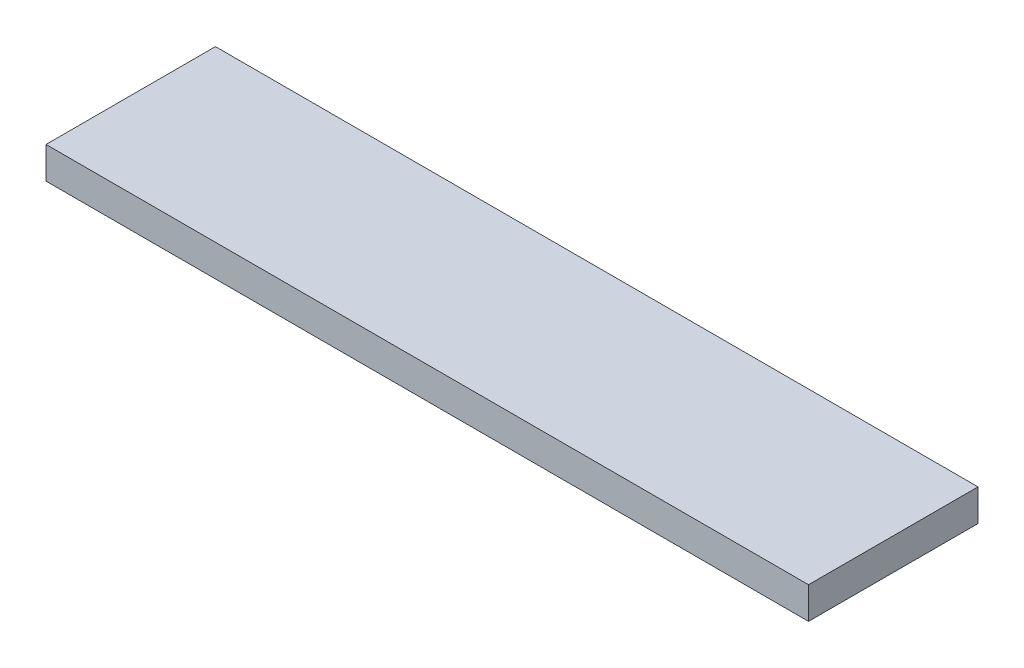
from build123d import *

# Parameters (mm, degrees)
SKETCH1_W           = 114.3
SKETCH1_H           = 4.7625
BOSS_EXTRUDE1_DEPTH = 25.4


with BuildPart() as part:
    # Sketch1 → Boss-Extrude1 (new body)
    with BuildSketch(Plane.XY):
        with Locations((-4.7625, -13.49375)):
            Rectangle(SKETCH1_W, SKETCH1_H)
    extrude(amount=BOSS_EXTRUDE1_DEPTH)


solid = part.part
